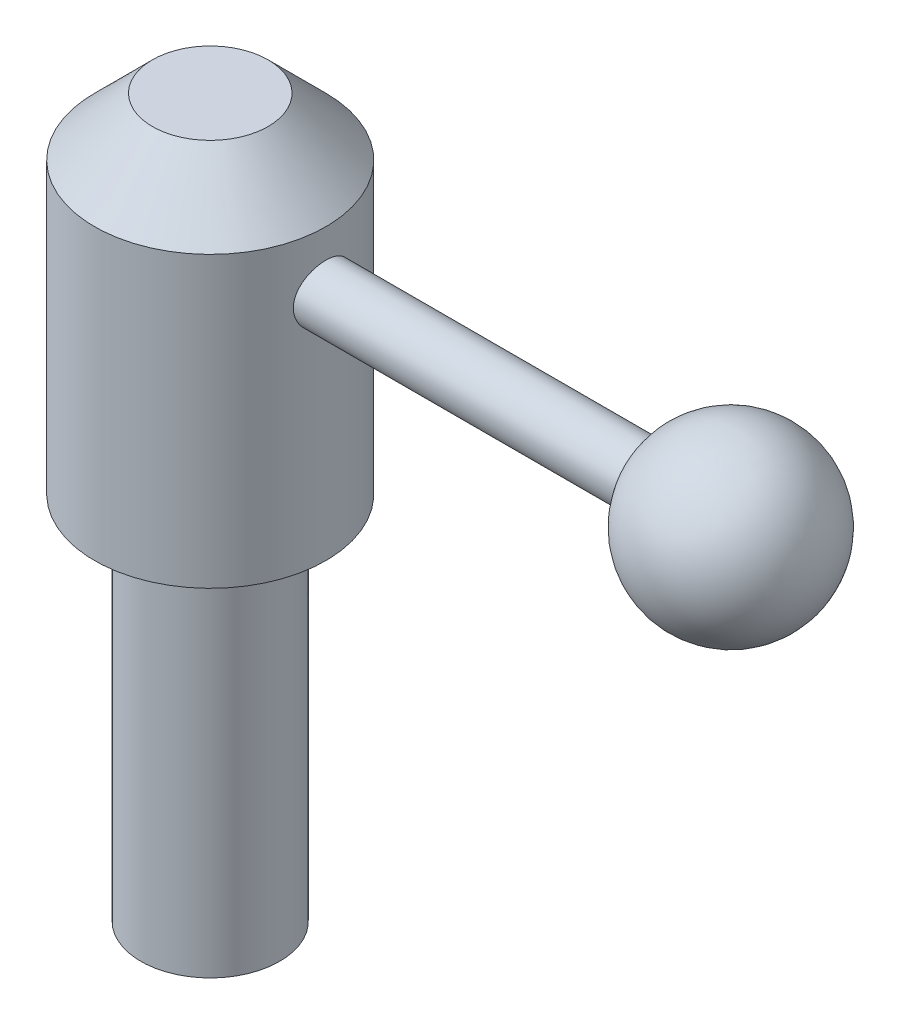
from build123d import *

# Parameters (mm, degrees)
CHAMFER1_SIZE = 5


with BuildPart() as part:
    # Sketch1 → Revolve1 (revolve)
    with BuildSketch(Plane.XY, mode=Mode.PRIVATE) as revolve1_sk:
        Polygon((0, 0), (-6, 0), (-6, 32), (-10, 32), (-10, 62), (0, 62), align=None)
    revolve(revolve1_sk.sketch.rotate(Axis((0, 0, 0), (0, 1, 0)), 270), axis=Axis((0, 0, 0), (0, 1, 0)))

    # Chamfer1
    chamfer1_edges = [part.edges().sort_by_distance(p)[0] for p in [
        (0, 62, 10),
    ]]
    chamfer(chamfer1_edges, length=CHAMFER1_SIZE)

    # Sketch2 → Revolve2 (revolve)
    with BuildSketch(Plane.XY, mode=Mode.PRIVATE) as revolve2_sk:
        with BuildLine():
            Line((0, 52), (0, 54.5))
            Line((0, 54.5), (37.928932188, 54.5))
            ThreePointArc((37.928932188, 54.5), (46.26826484, 59.391989197), (52.5, 52))
            Line((52.5, 52), (0, 52))
        make_face()
    revolve(revolve2_sk.sketch.rotate(Axis((0, 52, 0), (1, 0, 0)), 90), axis=Axis((0, 52, 0), (1, 0, 0)))


solid = part.part
